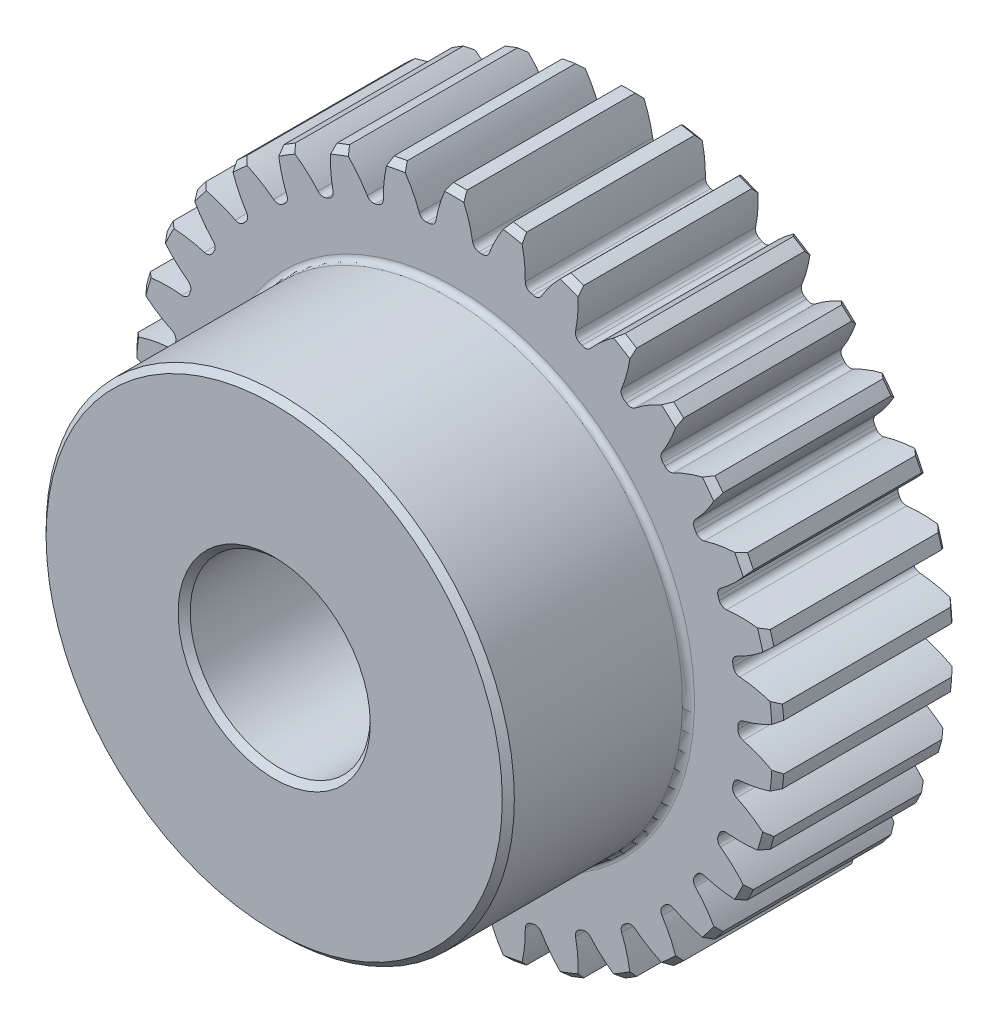
from build123d import *

# Parameters (mm, degrees)
BOSS_EXTRUDE1_DEPTH      = 10
BOSS_EXTRUDE1_DEPTH_BACK = 10
SKETCH3_R                = 18
SKETCH5_W                = 10
SKETCH5_H                = 5
SKETCH5_W_2              = 20
FILLET2_R                = 0.335505036
CHAMFER1_SIZE            = 0.335505036
CUT_EXTRUDE1_DEPTH       = 28.349588662
FILLET1_R                = 0.392699082
CIRPATTERN1_COUNT        = 34
FILLET1_OF_CIRPATTERN1_R = 0.392699082


with BuildPart() as part:
    # Sketch3 → Boss-Extrude1 (new, two sides: drawn at the far end of the back side and taken through both)
    with BuildSketch(Plane.XY.offset(-BOSS_EXTRUDE1_DEPTH_BACK)):
        Circle(SKETCH3_R)
    extrude(amount=BOSS_EXTRUDE1_DEPTH + BOSS_EXTRUDE1_DEPTH_BACK)

    # Sketch5 → Cut-Revolve1 (revolve, cut)
    with BuildSketch(Plane(origin=(0, 0, 0), x_dir=(0, 0, -1), z_dir=(1, 0, 0)), mode=Mode.PRIVATE) as cut_revolve1_sk:
        with Locations((-5, 15.5)):
            Rectangle(SKETCH5_W, SKETCH5_H)
        with Locations((0, 2.5)):
            Rectangle(SKETCH5_W_2, SKETCH5_H)
    revolve(cut_revolve1_sk.sketch.rotate(Axis((0, 0, 10), (0, 0, -1)), 180), axis=Axis((0, 0, 10), (0, 0, -1)), mode=Mode.SUBTRACT)

    # Fillet2
    fillet2_edges = [part.edges().sort_by_distance(p)[0] for p in [
        (0, 13, 0),
    ]]
    fillet(fillet2_edges, radius=FILLET2_R)

    # Chamfer1
    chamfer1_edges = [part.edges().sort_by_distance(p)[0] for p in [
        (0, 5, 10),
        (0, 5, -10),
        (-18, 0, 0),
        (0, 13, 10),
        (-18, 0, -10),
    ]]
    chamfer(chamfer1_edges, length=CHAMFER1_SIZE)

    # Sketch4 → Cut-Extrude1 (cut, symmetric)
    with BuildSketch(Plane.XY):
        with BuildLine():
            Line((15.745103602, 0.392699082), (15.745103602, -0.392699082))
            ThreePointArc((15.745103602, -0.392699082), (16.886595835, -0.748794922), (17.953857858, -1.288017084))
            ThreePointArc((17.953857858, -1.288017084), (18, 0), (17.953857858, 1.288017084))
            ThreePointArc((17.953857858, 1.288017084), (16.886595835, 0.748794922), (15.745103602, 0.392699082))
        make_face()
    cut_extrude1 = extrude(amount=CUT_EXTRUDE1_DEPTH, both=True, mode=Mode.SUBTRACT)

    # Fillet1
    fillet1_edges = [part.edges().sort_by_distance(p)[0] for p in [
        (15.745103602, 0.392699082, -5),
        (15.745103602, -0.392699082, -5),
    ]]
    fillet(fillet1_edges, radius=FILLET1_R)

    # CirPattern1: Cut-Extrude1 ×34 about axis
    cirpattern1_axis = Axis((0, 0, 0), (0, 0, 1))
    for i in range(1, CIRPATTERN1_COUNT):
        add(cut_extrude1.rotate(cirpattern1_axis, i * 360 / CIRPATTERN1_COUNT), mode=Mode.SUBTRACT)

    # Fillet1 of CirPattern1
    fillet1_of_cirpattern1_edges = [part.edges().sort_by_distance(p)[0] for p in [
        (15.404855025, 3.279167828, -5),
        (15.549171559, 2.507142561, -5),
        (14.540012587, 6.053968448, -5),
        (14.823731128, 5.321606471, -5),
        (13.180027459, 8.622608432, -5),
        (13.593486313, 7.954849455, -5),
        (11.371212304, 10.897615828, -5),
        (11.900331625, 10.317199582, -5),
        (9.175164151, 12.801517988, -5),
        (9.801925416, 12.328209851, -5),
        (6.666666789, 14.269479806, -5),
        (7.369726393, 13.91939772, -5),
        (3.931144084, 15.251511604, -5),
        (4.686560177, 15.036577194, -5),
        (1.061750982, 15.714171466, -5),
        (1.843798776, 15.641704066, -5),
        (-1.843798776, 15.641704066, -5),
        (-1.061750982, 15.714171466, -5),
        (-4.686560177, 15.036577194, -5),
        (-3.931144084, 15.251511604, -5),
        (-7.369726393, 13.91939772, -5),
        (-6.666666789, 14.269479806, -5),
        (-9.801925416, 12.328209851, -5),
        (-9.175164151, 12.801517988, -5),
        (-11.900331625, 10.317199582, -5),
        (-11.371212304, 10.897615828, -5),
        (-13.593486313, 7.954849455, -5),
        (-13.180027459, 8.622608432, -5),
        (-14.823731128, 5.321606471, -5),
        (-14.540012587, 6.053968448, -5),
        (-15.549171559, 2.507142561, -5),
        (-15.404855025, 3.279167828, -5),
        (-15.745103602, -0.392699082, -5),
        (-15.745103602, 0.392699082, -5),
        (-15.404855025, -3.279167828, -5),
        (-15.549171559, -2.507142561, -5),
        (-14.540012587, -6.053968448, -5),
        (-14.823731128, -5.321606471, -5),
        (-13.180027459, -8.622608432, -5),
        (-13.593486313, -7.954849455, -5),
        (-11.371212304, -10.897615828, -5),
        (-11.900331625, -10.317199582, -5),
        (-9.175164151, -12.801517988, -5),
        (-9.801925416, -12.328209851, -5),
        (-6.666666789, -14.269479806, -5),
        (-7.369726393, -13.91939772, -5),
        (-3.931144084, -15.251511604, -5),
        (-4.686560177, -15.036577194, -5),
        (-1.061750982, -15.714171466, -5),
        (-1.843798776, -15.641704066, -5),
        (1.843798776, -15.641704066, -5),
        (1.061750982, -15.714171466, -5),
        (4.686560177, -15.036577194, -5),
        (3.931144084, -15.251511604, -5),
        (7.369726393, -13.91939772, -5),
        (6.666666789, -14.269479806, -5),
        (9.801925416, -12.328209851, -5),
        (9.175164151, -12.801517988, -5),
        (11.900331625, -10.317199582, -5),
        (11.371212304, -10.897615828, -5),
        (13.593486313, -7.954849455, -5),
        (13.180027459, -8.622608432, -5),
        (14.823731128, -5.321606471, -5),
        (14.540012587, -6.053968448, -5),
        (15.549171559, -2.507142561, -5),
        (15.404855025, -3.279167828, -5),
    ]]
    fillet(fillet1_of_cirpattern1_edges, radius=FILLET1_OF_CIRPATTERN1_R)


solid = part.part
